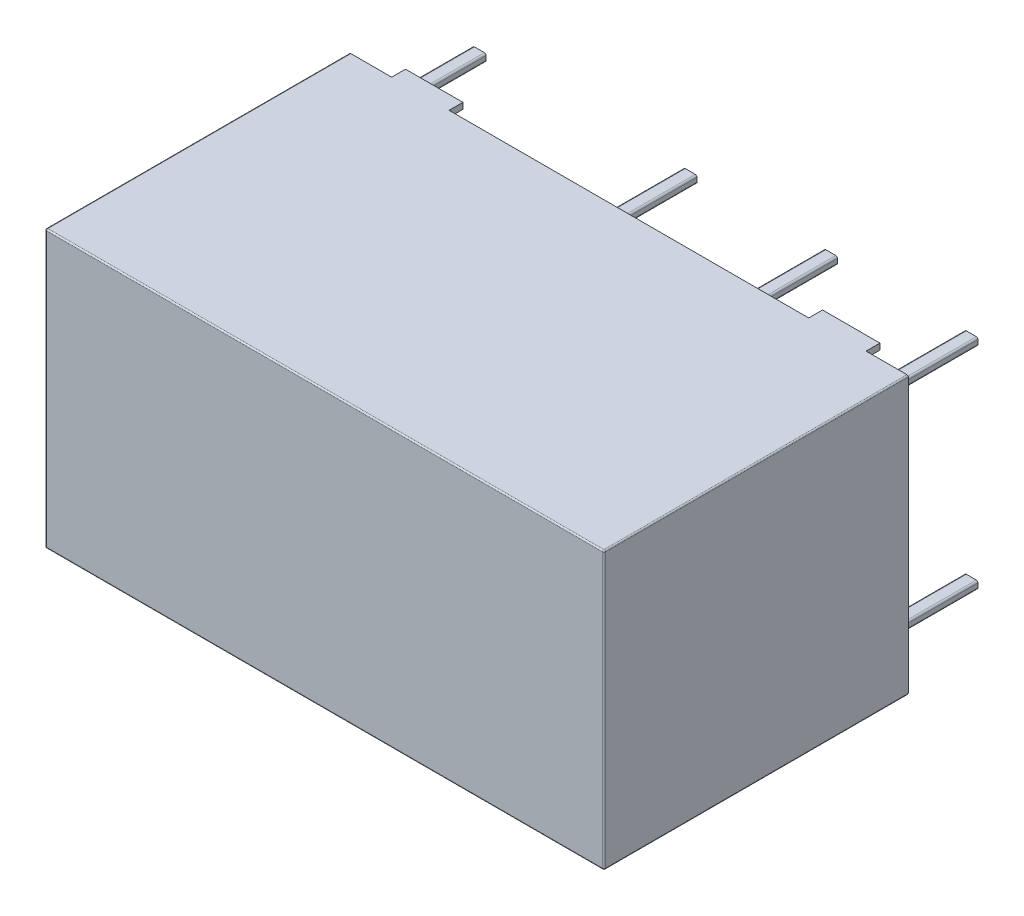
from build123d import *

# Parameters (mm, degrees)
SKETCH1_W            = 20.2
SKETCH1_H            = 10
BOSS_EXTRUDE1_DEPTH  = 11.5
SKETCH2_W            = 13
SKETCH2_H            = 10
SKETCH2_W_2          = 1.525
CUT_EXTRUDE1_DEPTH   = 0.5
SKETCH3_W            = 17.15
SKETCH3_H            = 9.56
CUT_EXTRUDE2_DEPTH   = 0.5
SKETCH4_W            = 0.48
SKETCH4_H            = 0.27
BOSS_EXTRUDE2_DEPTH  = 3.5
FILLET1_R            = 0.06
FILLET1_OF_MIRROR1_R = 0.06
FILLET2_R            = 0.05


with BuildPart() as part:
    # Sketch1 → Boss-Extrude1 (new body)
    with BuildSketch(Plane.XY):
        Rectangle(SKETCH1_W, SKETCH1_H)
    extrude(amount=BOSS_EXTRUDE1_DEPTH)

    # Sketch2 → Cut-Extrude1 (cut)
    with BuildSketch(Plane(origin=(0, 0, 0), x_dir=(-1, 0, 0), z_dir=(0, 0, -1))):
        Rectangle(SKETCH2_W, SKETCH2_H)
        with Locations((-9.3375, 0)):
            Rectangle(SKETCH2_W_2, SKETCH2_H)
        with Locations((9.3375, 0)):
            Rectangle(SKETCH2_W_2, SKETCH2_H)
    extrude(amount=-CUT_EXTRUDE1_DEPTH, mode=Mode.SUBTRACT)

    # Sketch3 → Cut-Extrude2 (cut)
    with BuildSketch(Plane(origin=(0, 0, 0), x_dir=(-1, 0, 0), z_dir=(0, 0, -1))):
        Rectangle(SKETCH3_W, SKETCH3_H)
    extrude(amount=-CUT_EXTRUDE2_DEPTH, mode=Mode.SUBTRACT)

    # Sketch4 → Boss-Extrude2 (add)
    with BuildSketch(Plane(origin=(0, 0, 0.5), x_dir=(-1, 0, 0), z_dir=(0, 0, -1))):
        with Locations((8.9, -3.81)):
            Rectangle(SKETCH4_W, SKETCH4_H)
        with Locations((1.28, -3.81)):
            Rectangle(SKETCH4_W, SKETCH4_H)
        with Locations((-3.8, -3.81)):
            Rectangle(SKETCH4_W, SKETCH4_H)
        with Locations((-8.88, -3.81)):
            Rectangle(SKETCH4_W, SKETCH4_H)
    boss_extrude2 = extrude(amount=BOSS_EXTRUDE2_DEPTH)

    # Fillet1
    fillet1_edges = [part.edges().sort_by_distance(p)[0] for p in [
        (-1.52, -3.675, -1.25),
        (-1.52, -3.945, -1.25),
        (-1.04, -3.945, -1.25),
        (-1.04, -3.675, -1.25),
        (3.56, -3.675, -1.25),
        (3.56, -3.945, -1.25),
        (4.04, -3.945, -1.25),
        (4.04, -3.675, -1.25),
        (8.64, -3.675, -1.25),
        (8.64, -3.945, -1.25),
        (9.12, -3.945, -1.25),
        (9.12, -3.675, -1.25),
        (-9.14, -3.675, -1.25),
        (-9.14, -3.945, -1.25),
        (-8.66, -3.945, -1.25),
        (-8.66, -3.675, -1.25),
    ]]
    fillet(fillet1_edges, radius=FILLET1_R)

    # Mirror1: Boss-Extrude2 across plane
    add(boss_extrude2.mirror(Plane.ZX))

    # Fillet1 of Mirror1
    fillet1_of_mirror1_edges = [part.edges().sort_by_distance(p)[0] for p in [
        (-1.52, 3.675, -1.25),
        (-1.52, 3.945, -1.25),
        (-1.04, 3.945, -1.25),
        (-1.04, 3.675, -1.25),
        (3.56, 3.675, -1.25),
        (3.56, 3.945, -1.25),
        (4.04, 3.945, -1.25),
        (4.04, 3.675, -1.25),
        (8.64, 3.675, -1.25),
        (8.64, 3.945, -1.25),
        (9.12, 3.945, -1.25),
        (9.12, 3.675, -1.25),
        (-9.14, 3.675, -1.25),
        (-9.14, 3.945, -1.25),
        (-8.66, 3.945, -1.25),
        (-8.66, 3.675, -1.25),
    ]]
    fillet(fillet1_of_mirror1_edges, radius=FILLET1_OF_MIRROR1_R)

    # Fillet2
    fillet2_edges = [part.edges().sort_by_distance(p)[0] for p in [
        (-10.1, 0, 11.5),
        (0, -5, 11.5),
        (10.1, 0, 11.5),
        (0, 5, 11.5),
        (10.1, -5, 6),
        (-10.1, -5, 6),
        (-10.1, 5, 6),
        (10.1, 5, 6),
    ]]
    fillet(fillet2_edges, radius=FILLET2_R)


solid = part.part
